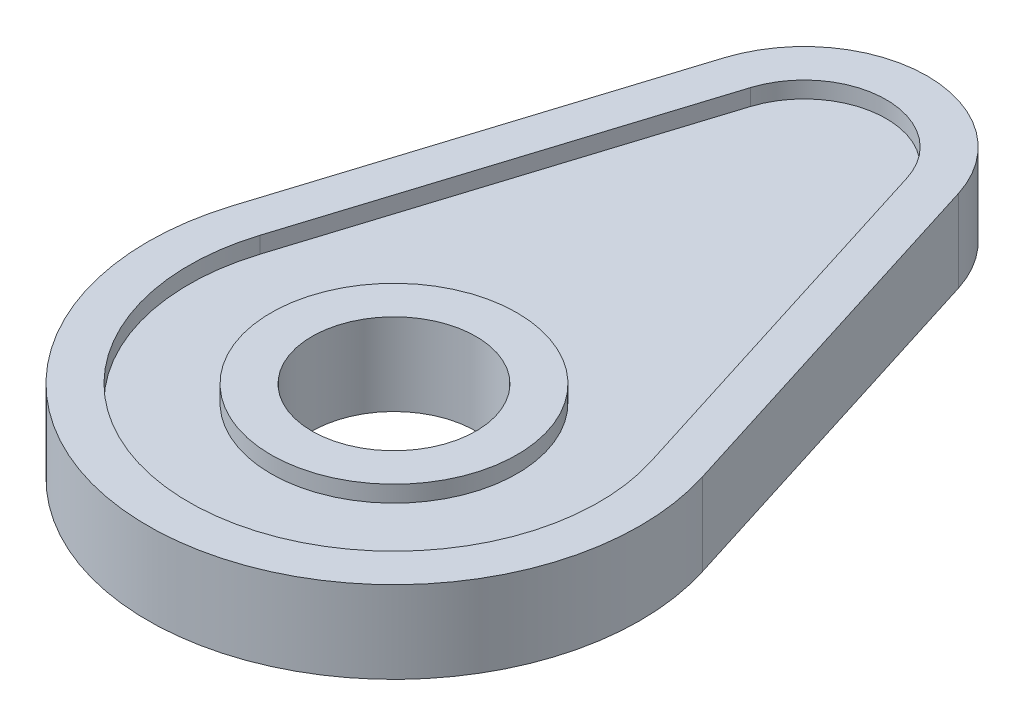
from build123d import *

# Parameters (mm, degrees)
BOSS_EXTRUDE1_DEPTH = 5
CUT_EXTRUDE1_DEPTH  = 2
SKETCH3_R           = 10
CUT_EXTRUDE4_DEPTH  = 73.034713854
BOSS_EXTRUDE2_START = 2
SKETCH5_R           = 15
SKETCH5_R_2         = 10
BOSS_EXTRUDE2_DEPTH = 2


with BuildPart() as part:
    # Sketch1 → Boss-Extrude1 (new, symmetric)
    with BuildSketch(Plane(origin=(0, 0, 0), x_dir=(1, 0, 0), z_dir=(0, 1, 0))):
        with BuildLine():
            Line((-28.618176043, 9), (-14.309088021, 54.5))
            ThreePointArc((-14.309088021, 54.5), (0, 65), (14.309088021, 54.5))
            Line((14.309088021, 54.5), (28.618176043, 9))
            ThreePointArc((28.618176043, 9), (0, -30), (-28.618176043, 9))
        make_face()
    extrude(amount=BOSS_EXTRUDE1_DEPTH, both=True)

    # Sketch2 → Cut-Extrude1 (cut)
    with BuildSketch(Plane(origin=(0, 5, 0), x_dir=(1, 0, 0), z_dir=(0, 1, 0))):
        with BuildLine():
            Line((-9.539392014, 53), (-23.848480035, 7.5))
            ThreePointArc((-23.848480035, 7.5), (0, -25), (23.848480035, 7.5))
            Line((23.848480035, 7.5), (9.539392014, 53))
            ThreePointArc((9.539392014, 53), (0, 60), (-9.539392014, 53))
        make_face()
    cut_extrude1 = extrude(amount=-CUT_EXTRUDE1_DEPTH, mode=Mode.SUBTRACT)

    # Mirror1: Cut-Extrude1 across plane
    add(cut_extrude1.mirror(Plane.ZX), mode=Mode.SUBTRACT)

    # Sketch3 → Cut-Extrude4 (cut, through all)
    with BuildSketch(Plane(origin=(0, 3, 0), x_dir=(1, 0, 0), z_dir=(0, 1, 0))):
        with Locations(Location((0, 0, 0), (0, 0, 270))):
            Circle(SKETCH3_R)
    extrude(amount=-CUT_EXTRUDE4_DEPTH, mode=Mode.SUBTRACT)

    # Sketch5 → Boss-Extrude2 (add)
    with BuildSketch(Plane(origin=(0, 3, 0), x_dir=(1, 0, 0), z_dir=(0, 1, 0)).offset(BOSS_EXTRUDE2_START)):
        with Locations(Location((0, 0, 0), (0, 0, 270))):
            Circle(SKETCH5_R)
        with Locations(Location((0, 0, 0), (0, 0, 270))):
            Circle(SKETCH5_R_2, mode=Mode.SUBTRACT)
    boss_extrude2 = extrude(amount=-BOSS_EXTRUDE2_DEPTH)

    # Mirror2: Boss-Extrude2 across plane
    add(boss_extrude2.mirror(Plane.ZX))


solid = part.part
